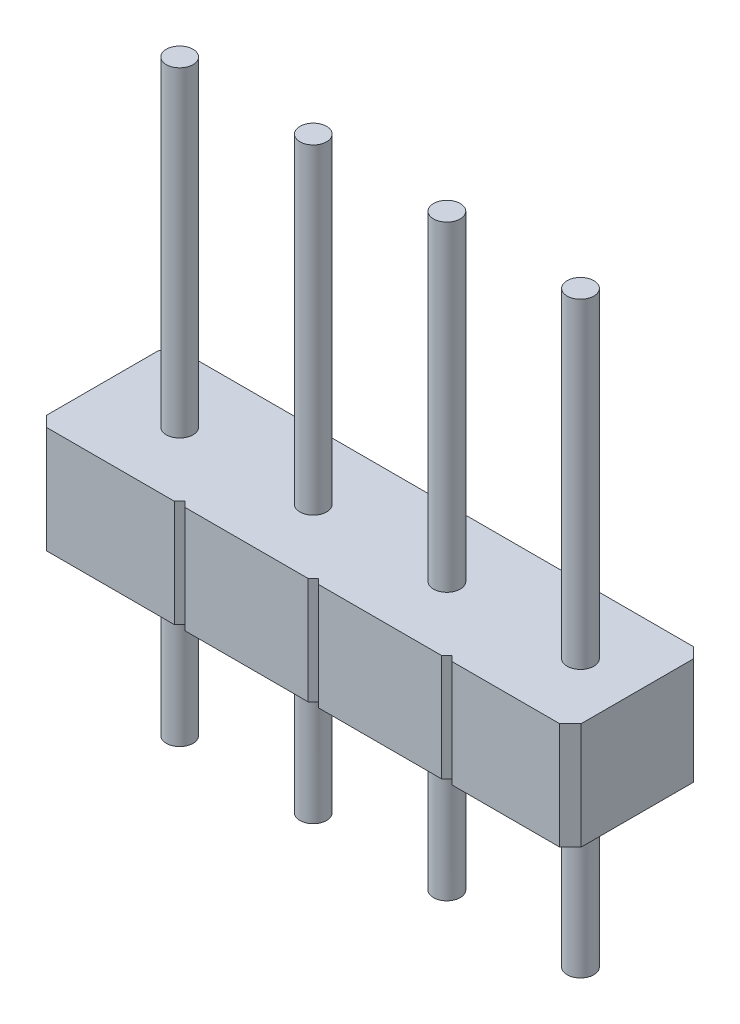
from build123d import *

# Parameters (mm, degrees)
IZIM1_R                          = 0.25
Y_KSEKLIK_EKSTR_ZYON1_DEPTH      = 2
Y_KSEKLIK_EKSTR_ZYON2_DEPTH      = 6
Y_KSEKLIK_EKSTR_ZYON2_DEPTH_BACK = 5
IZIM2_R                          = 0.25


with BuildPart() as part:
    # Çizim1 → Yükseklik-Ekstrüzyon1 (new body)
    with BuildSketch(Plane(origin=(0, 0, 0), x_dir=(1, 0, 0), z_dir=(0, 1, 0))):
        Polygon((-4.8, 1.25), (-2.412060191, 1.25), (-2.311389974, 1.122349253), (-2.210719757, 1.25), (0.088610026, 1.25), (0.188610026, 1.15), (0.288610026, 1.25), (2.588610026, 1.25), (2.688610026, 1.15), (2.788610026, 1.25), (4.8, 1.25), (5, 1.05), (5, -1.05), (4.8, -1.25), (2.788610026, -1.25), (2.688610026, -1.15), (2.588610026, -1.25), (0.288610026, -1.25), (0.188610026, -1.15), (0.088610026, -1.25), (-2.211389974, -1.25), (-2.311389974, -1.15), (-2.411389974, -1.25), (-4.8, -1.25), (-5, -1.05), (-5, 1.05), align=None)
        with Locations(Location((-3.561389974, 0, 0), (0, 0, 270))):
            Circle(IZIM1_R, mode=Mode.SUBTRACT)
        with Locations(Location((-1.061389974, 0, 0), (0, 0, 270))):
            Circle(IZIM1_R, mode=Mode.SUBTRACT)
        with Locations(Location((1.438610026, 0, 0), (0, 0, 270))):
            Circle(IZIM1_R, mode=Mode.SUBTRACT)
        with Locations(Location((3.938610026, 0, 0), (0, 0, 270))):
            Circle(IZIM1_R, mode=Mode.SUBTRACT)
    extrude(amount=Y_KSEKLIK_EKSTR_ZYON1_DEPTH)

    # Çizim2 → Yükseklik-Ekstrüzyon2 (add, two sides: drawn at the far end of the back side and taken through both)
    with BuildSketch(Plane(origin=(0, 2, 0), x_dir=(1, 0, 0), z_dir=(0, 1, 0)).offset(-Y_KSEKLIK_EKSTR_ZYON2_DEPTH_BACK)):
        with Locations(Location((-3.561389974, 0, 0), (0, 0, 270))):
            Circle(IZIM2_R)
        with Locations(Location((-1.061389974, 0, 0), (0, 0, 270))):
            Circle(IZIM2_R)
        with Locations(Location((1.438610026, 0, 0), (0, 0, 270))):
            Circle(IZIM2_R)
        with Locations(Location((3.938610026, 0, 0), (0, 0, 270))):
            Circle(IZIM2_R)
    extrude(amount=Y_KSEKLIK_EKSTR_ZYON2_DEPTH + Y_KSEKLIK_EKSTR_ZYON2_DEPTH_BACK)


solid = part.part
